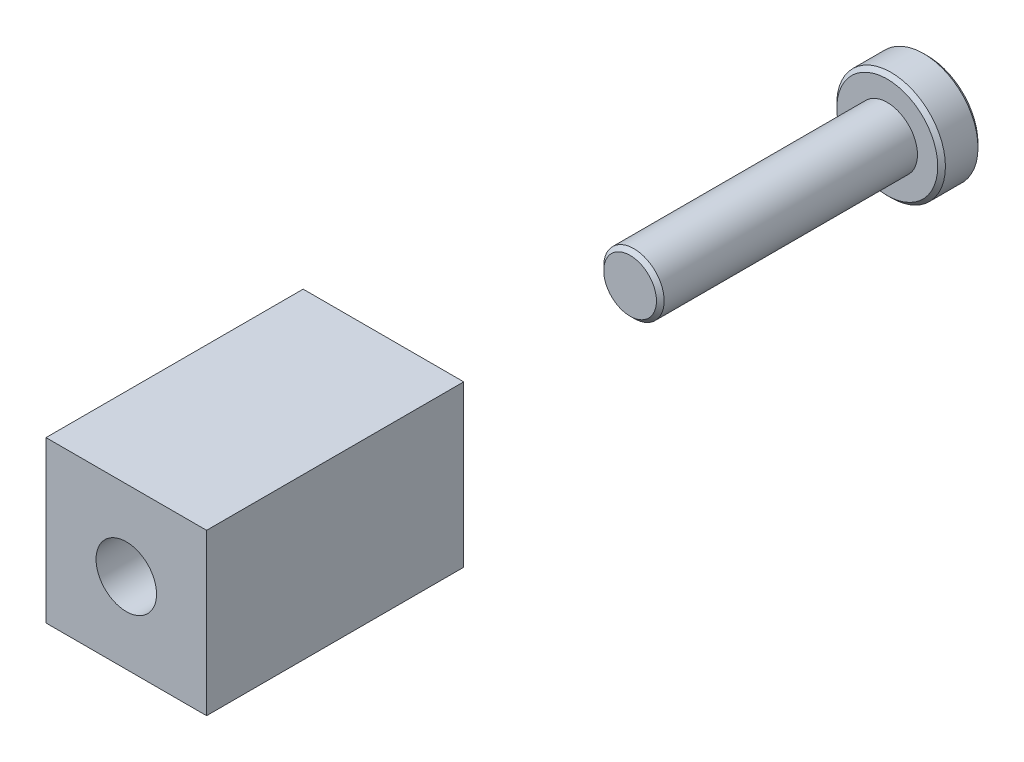
from build123d import *

# Parameters (mm, degrees)
SKETCH1_R           = 10.7315
BOSS_EXTRUDE1_DEPTH = 7.958666667
SKETCH2_R           = 5.969
BOSS_EXTRUDE2_DEPTH = 50.8
SKETCH3_W           = 31.722698392
SKETCH3_H           = 31.722698392
BOSS_EXTRUDE3_DEPTH = 50.8
SKETCH4_R           = 5.97535
CUT_EXTRUDE1_DEPTH  = 110.798996017
CHAMFER1_SIZE       = 0.762


with BuildPart() as part:
    # Sketch1 → Boss-Extrude1 (new body)
    with BuildSketch(Plane.XY):
        Circle(SKETCH1_R)
    extrude(amount=BOSS_EXTRUDE1_DEPTH)

    # Sketch2 → Boss-Extrude2 (add)
    with BuildSketch(Plane.XY.offset(7.958666667)):
        Circle(SKETCH2_R)
    extrude(amount=BOSS_EXTRUDE2_DEPTH)

    # Chamfer1
    chamfer1_edges = [part.edges().sort_by_distance(p)[0] for p in [
        (-10.7315, 0, 0),
        (-10.7315, 0, 7.958666667),
        (-5.969, 0, 58.758666667),
    ]]
    chamfer(chamfer1_edges, length=CHAMFER1_SIZE)


with BuildPart() as body_2:
    # Sketch3 → Boss-Extrude3 (new body)
    with BuildSketch(Plane.XY.offset(107.483276511)):
        Rectangle(SKETCH3_W, SKETCH3_H)
    extrude(amount=BOSS_EXTRUDE3_DEPTH)

    # Sketch4 → Cut-Extrude1 (cut, through all)
    with BuildSketch(Plane(origin=(0, 0, 107.483276511), x_dir=(-1, 0, 0), z_dir=(0, 0, -1))):
        Circle(SKETCH4_R)
    extrude(amount=-CUT_EXTRUDE1_DEPTH, mode=Mode.SUBTRACT)


solid = Compound([part.part, body_2.part])
